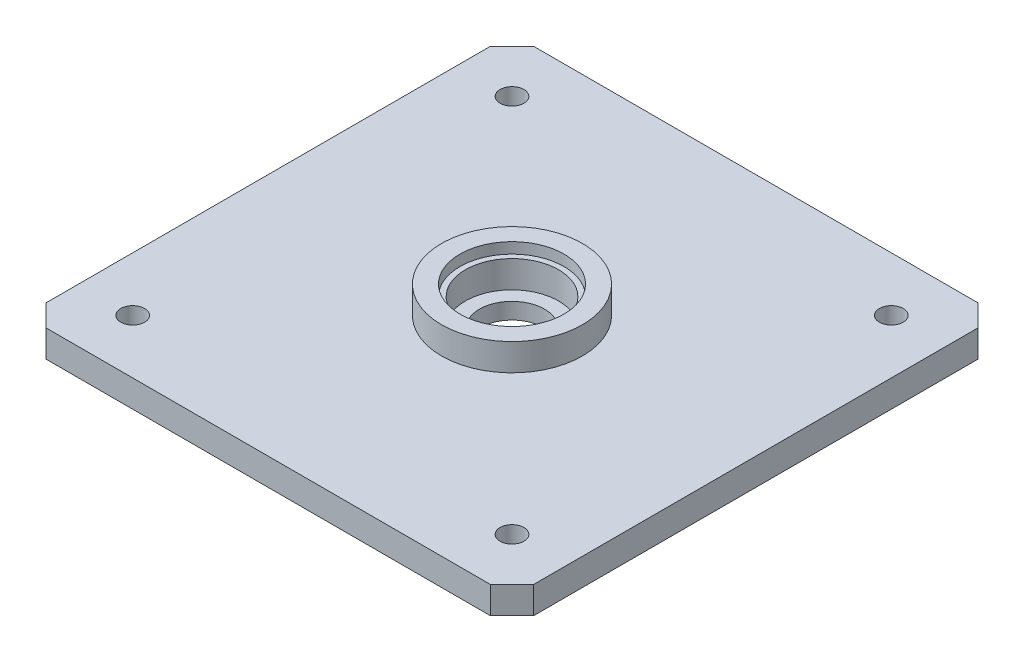
from build123d import *

# Parameters (mm, degrees)
SKETCH1_W           = 90
SKETCH1_H           = 90
SKETCH1_R           = 2.2
SKETCH1_R_2         = 13
BOSS_EXTRUDE1_DEPTH = 5
SKETCH1_3_R         = 13
SKETCH1_3_R_2       = 6
BOSS_EXTRUDE2_DEPTH = 3
SKETCH1_4_R         = 13
SKETCH1_4_R_2       = 8.6
BOSS_EXTRUDE3_DEPTH = 8
SKETCH1_5_R         = 13
SKETCH1_5_R_2       = 9.6
BOSS_EXTRUDE4_DEPTH = 10
CHAMFER1_SIZE       = 4


with BuildPart() as part:
    # Sketch1 → Boss-Extrude1 (new body)
    with BuildSketch(Plane(origin=(0, 0, 0), x_dir=(1, 0, 0), z_dir=(0, 1, 0))):
        Rectangle(SKETCH1_W, SKETCH1_H)
        with Locations((-35, -35)):
            Circle(SKETCH1_R, mode=Mode.SUBTRACT)
        with Locations((35, -35)):
            Circle(SKETCH1_R, mode=Mode.SUBTRACT)
        with Locations((-35, 35)):
            Circle(SKETCH1_R, mode=Mode.SUBTRACT)
        Circle(SKETCH1_R_2, mode=Mode.SUBTRACT)
        with Locations((35, 35)):
            Circle(SKETCH1_R, mode=Mode.SUBTRACT)
    extrude(amount=BOSS_EXTRUDE1_DEPTH)

    # Sketch1<3> → Boss-Extrude2 (add)
    with BuildSketch(Plane(origin=(0, 0, 0), x_dir=(1, 0, 0), z_dir=(0, 1, 0))):
        Circle(SKETCH1_3_R)
        Circle(SKETCH1_3_R_2, mode=Mode.SUBTRACT)
    extrude(amount=BOSS_EXTRUDE2_DEPTH)

    # Sketch1<4> → Boss-Extrude3 (add)
    with BuildSketch(Plane(origin=(0, 0, 0), x_dir=(1, 0, 0), z_dir=(0, 1, 0))):
        Circle(SKETCH1_4_R)
        Circle(SKETCH1_4_R_2, mode=Mode.SUBTRACT)
    extrude(amount=BOSS_EXTRUDE3_DEPTH)

    # Sketch1<5> → Boss-Extrude4 (add)
    with BuildSketch(Plane(origin=(0, 0, 0), x_dir=(1, 0, 0), z_dir=(0, 1, 0))):
        Circle(SKETCH1_5_R)
        Circle(SKETCH1_5_R_2, mode=Mode.SUBTRACT)
    extrude(amount=BOSS_EXTRUDE4_DEPTH)

    # Chamfer1
    chamfer1_edges = [part.edges().sort_by_distance(p)[0] for p in [
        (-45, 2.5, -45),
        (45, 2.5, -45),
        (-45, 2.5, 45),
        (45, 2.5, 45),
    ]]
    chamfer(chamfer1_edges, length=CHAMFER1_SIZE)


solid = part.part
